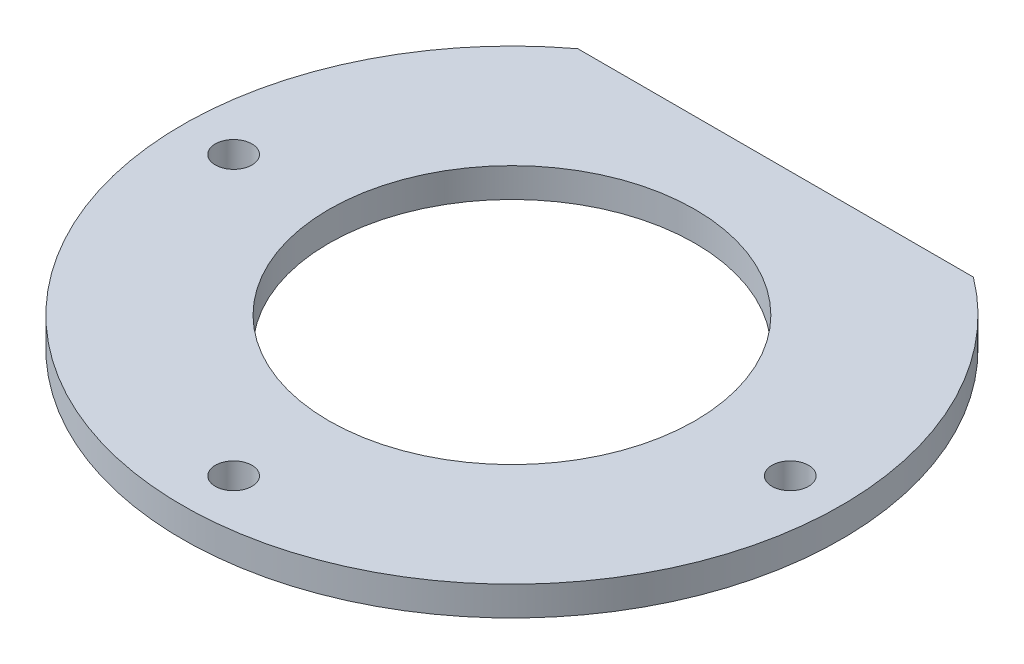
from build123d import *

# Parameters (mm, degrees)
SKETCH_1_R          = 22.5
SKETCH_1_R_2        = 12.5
EXTRUDE_1_DEPTH     = 2
SKETCH_2_R          = 1.25
CUT_EXTRUDE_1_DEPTH = 2


with BuildPart() as part:
    # Эскиз1 → Бобышка-Вытянуть1 (new body)
    with BuildSketch(Plane(origin=(0, 0, 0), x_dir=(1, 0, 0), z_dir=(0, 1, 0))):
        with Locations(Location((0, 0, 0), (0, 0, 270))):
            Circle(SKETCH_1_R)
        with Locations(Location((0, 0, 0), (0, 0, 270))):
            Circle(SKETCH_1_R_2, mode=Mode.SUBTRACT)
    extrude(amount=EXTRUDE_1_DEPTH)

    # Эскиз2 → Вырез-Вытянуть1 (cut)
    with BuildSketch(Plane(origin=(0, 2, 0), x_dir=(1, 0, 0), z_dir=(0, 1, 0))):
        with Locations(Location((-19, 0, 0), (0, 0, 270))):
            Circle(SKETCH_2_R)
        with Locations(Location((19, 0, 0), (0, 0, 270))):
            Circle(SKETCH_2_R)
        with Locations(Location((0, -19, 0), (0, 0, 270))):
            Circle(SKETCH_2_R)
        Polygon((-20.23493598, 18), (18.121302114, 18), (0, 26.542268098), align=None)
    extrude(amount=-CUT_EXTRUDE_1_DEPTH, mode=Mode.SUBTRACT)


solid = part.part
